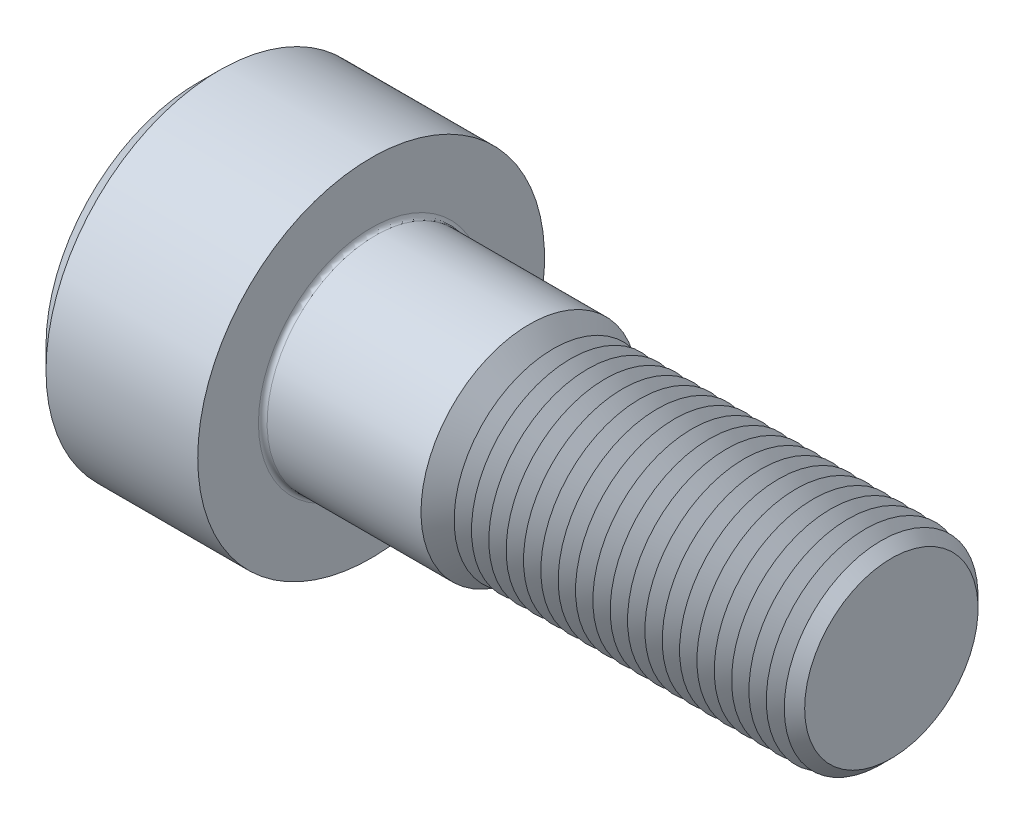
from build123d import *

# Parameters (mm, degrees)
FILLET1_R       = 0.1
HEX_2_DEPTH     = 1
THDSCHPAT_COUNT = 20
THDSCHPAT_PITCH = 0.4


with BuildPart() as part:
    # BodySke → Base-Revolve (revolve)
    with BuildSketch(Plane.XY, mode=Mode.PRIVATE) as base_revolve_sk:
        Polygon((0, 0), (0, 3.5), (0.5, 4), (4, 4), (4, 2.5), (15.5, 2.5), (16, 2), (16, 0), align=None)
    revolve(base_revolve_sk.sketch.rotate(Axis((-31.75, 0, 0), (1, 0, 0)), 90), axis=Axis((-31.75, 0, 0), (1, 0, 0)))

    # Fillet1
    fillet1_edges = [part.edges().sort_by_distance(p)[0] for p in [
        (4, 0, -2.5),
    ]]
    fillet(fillet1_edges, radius=FILLET1_R)

    # Sketch2 → Hex-PreBroach (revolve, cut)
    with BuildSketch(Plane.XY, mode=Mode.PRIVATE) as hex_prebroach_sk:
        Polygon((0, 0.7725), (1, 0.7725), (1.446003083, 0), (0, 0), align=None)
    revolve(hex_prebroach_sk.sketch.rotate(Axis((0, 0, 0), (1, 0, 0)), 90), axis=Axis((0, 0, 0), (1, 0, 0)), mode=Mode.SUBTRACT)

    # Sketch3 → Hex 2 (cut)
    with BuildSketch(Plane(origin=(0, 0, 0), x_dir=(0, 0.500000000000001, 0.866025403784438), z_dir=(-1, 0, 0))):
        Polygon((0.446003083, 0.7725), (-0.446003083, 0.7725), (-0.892006166, 0), (-0.446003083, -0.7725), (0.446003083, -0.7725), (0.892006166, 0), align=None)
    extrude(amount=-HEX_2_DEPTH, mode=Mode.SUBTRACT)

    # ThdSchSke → ThreadSchematic (revolve, cut)
    with BuildSketch(Plane.XY):
        Polygon((8, -2), (7.649896231, -2.5), (7.649896231, -3.125), (8.350103769, -3.125), (8.350103769, -2.5), align=None)
    threadschematic = revolve(axis=Axis((-3.175, 0, 0), (1, 0, 0)), mode=Mode.SUBTRACT)

    # ThdSchPat: ThreadSchematic ×20
    with Locations(*[(i * THDSCHPAT_PITCH, 0, 0) for i in range(1, THDSCHPAT_COUNT)]):
        add(threadschematic, mode=Mode.SUBTRACT)


solid = part.part
